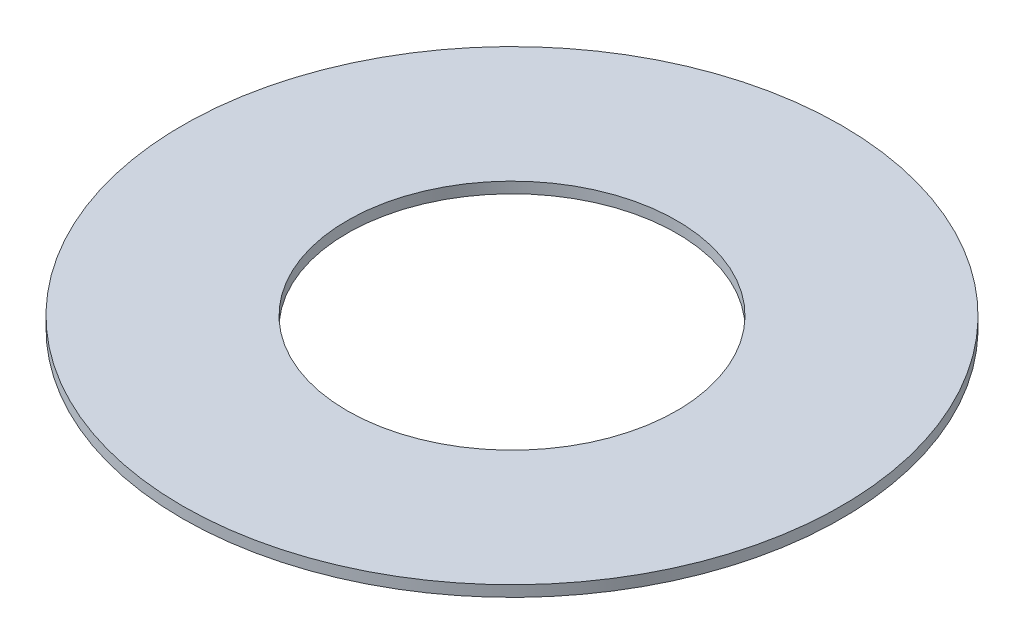
from build123d import *

# Parameters (mm, degrees)
SKETCH1_R           = 6
BOSS_EXTRUDE1_DEPTH = 0.2
SKETCH5_R           = 3
CUT_EXTRUDE1_DEPTH  = 9.48763807


with BuildPart() as part:
    # Sketch1 → Boss-Extrude1 (new body)
    with BuildSketch(Plane(origin=(0, 0, 0), x_dir=(1, 0, 0), z_dir=(0, 1, 0))):
        with Locations(Location((0, 0, 0), (0, 0, 270))):
            Circle(SKETCH1_R)
    extrude(amount=BOSS_EXTRUDE1_DEPTH)

    # Sketch5 → Cut-Extrude1 (cut, through all)
    with BuildSketch(Plane(origin=(0, 0.2, 0), x_dir=(-1, 0, 0), z_dir=(0, 1, 0))):
        with Locations(Location((0, 0, 0), (0, 0, 90))):
            Circle(SKETCH5_R)
    extrude(amount=-CUT_EXTRUDE1_DEPTH, mode=Mode.SUBTRACT)


solid = part.part
